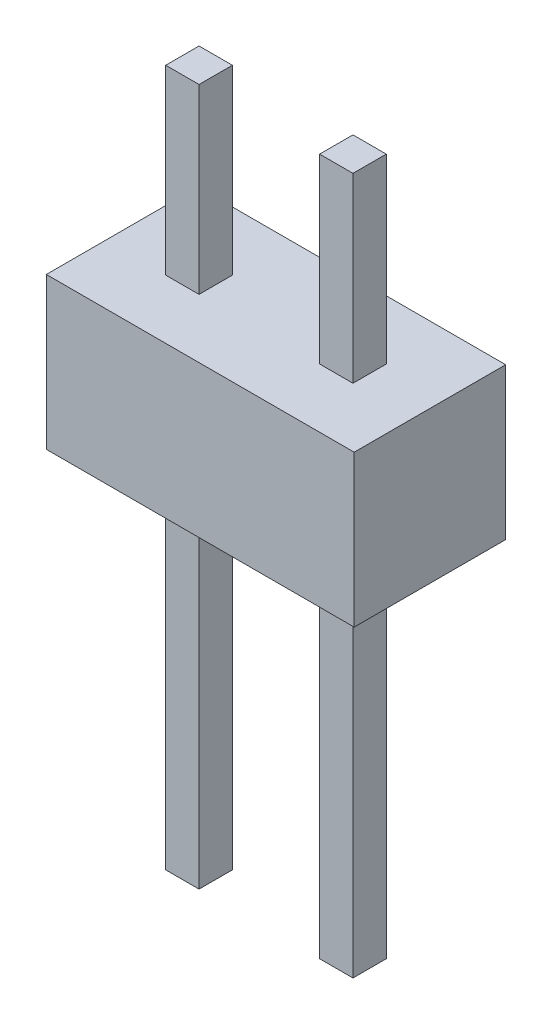
from build123d import *

# Parameters (mm, degrees)
SKETCH1_W             = 5.08
SKETCH1_H             = 2.5
BOSS_EXTRUDE1_DEPTH   = 1.25
SKETCH2_W             = 0.55
SKETCH2_H             = 0.55
BOSS_EXTRUDE2_DEPTH   = 6
BOSS_EXTRUDE2_2_DEPTH = 6
SKETCH2_2_W           = 0.55
SKETCH2_2_H           = 0.55
BOSS_EXTRUDE3_DEPTH   = 5.5
BOSS_EXTRUDE3_2_DEPTH = 5.5


with BuildPart() as part:
    # Sketch1 → Boss-Extrude1 (new, symmetric)
    with BuildSketch(Plane.XY):
        with Locations((2.54, 1.25)):
            Rectangle(SKETCH1_W, SKETCH1_H)
    extrude(amount=BOSS_EXTRUDE1_DEPTH, both=True)


with BuildPart() as body_2:
    # Sketch2 → Boss-Extrude2 (new body)
    with BuildSketch(Plane.XZ):
        with Locations((3.81, 0)):
            Rectangle(SKETCH2_W, SKETCH2_H)
    extrude(amount=BOSS_EXTRUDE2_DEPTH)


with BuildPart() as body_3:
    # Sketch2 → Boss-Extrude2 2 (new body)
    with BuildSketch(Plane.XZ):
        with Locations((1.27, 0)):
            Rectangle(SKETCH2_W, SKETCH2_H)
    extrude(amount=BOSS_EXTRUDE2_2_DEPTH)


with BuildPart() as body_4:
    # Sketch2<2> → Boss-Extrude3 (new body)
    with BuildSketch(Plane.XZ):
        with Locations((3.81, 0)):
            Rectangle(SKETCH2_2_W, SKETCH2_2_H)
    extrude(amount=-BOSS_EXTRUDE3_DEPTH)


with BuildPart() as body_5:
    # Sketch2<2> → Boss-Extrude3 2 (new body)
    with BuildSketch(Plane.XZ):
        with Locations((1.27, 0)):
            Rectangle(SKETCH2_2_W, SKETCH2_2_H)
    extrude(amount=-BOSS_EXTRUDE3_2_DEPTH)


solid = Compound([part.part, body_2.part, body_3.part, body_4.part, body_5.part])
